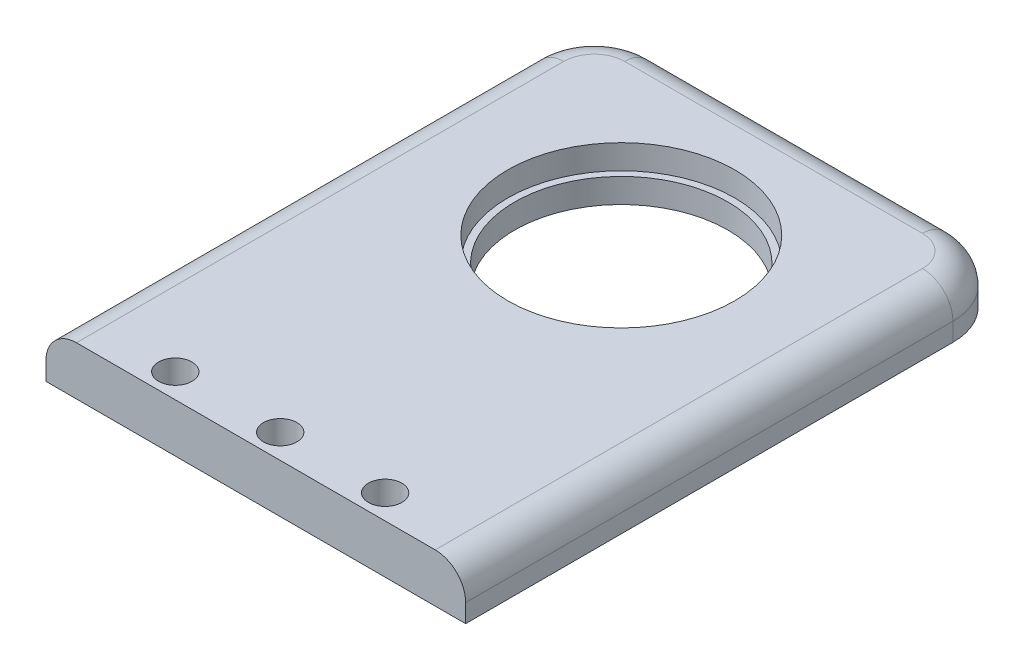
from build123d import *

# Parameters (mm, degrees)
SKETCH1_W           = 68.9
SKETCH1_H           = 90
SKETCH1_R           = 18.63
SKETCH1_R_2         = 2.75
BOSS_EXTRUDE1_DEPTH = 8
FILLET1_R           = 10
FILLET2_R           = 5
SKETCH2_R           = 18.63
SKETCH2_R_2         = 17.5
BOSS_EXTRUDE2_DEPTH = 4


with BuildPart() as part:
    # Sketch1 → Boss-Extrude1 (new body)
    with BuildSketch(Plane(origin=(0, 0, 0), x_dir=(1, 0, 0), z_dir=(0, 1, 0))):
        with Locations((0.722348924, 5)):
            Rectangle(SKETCH1_W, SKETCH1_H)
        with Locations(Location((0.722348924, 20, 0), (0, 0, 270))):
            Circle(SKETCH1_R, mode=Mode.SUBTRACT)
        with Locations(Location((0.722348924, -36, 0), (0, 0, 270))):
            Circle(SKETCH1_R_2, mode=Mode.SUBTRACT)
        with Locations(Location((-16.502651076, -36, 0), (0, 0, 270))):
            Circle(SKETCH1_R_2, mode=Mode.SUBTRACT)
        with Locations(Location((17.947348924, -36, 0), (0, 0, 270))):
            Circle(SKETCH1_R_2, mode=Mode.SUBTRACT)
    extrude(amount=BOSS_EXTRUDE1_DEPTH)

    # Fillet1
    fillet1_edges = [part.edges().sort_by_distance(p)[0] for p in [
        (-33.727651076, 4, -50),
        (35.172348924, 4, -50),
    ]]
    fillet(fillet1_edges, radius=FILLET1_R)

    # Fillet2
    fillet2_edges = [part.edges().sort_by_distance(p)[0] for p in [
        (35.172348924, 8, 0),
        (0.722348924, 8, -50),
        (-33.727651076, 8, 0),
        (-30.798718888, 8, -47.071067812),
        (32.243416735, 8, -47.071067812),
    ]]
    fillet(fillet2_edges, radius=FILLET2_R)

    # Sketch2 → Boss-Extrude2 (add)
    with BuildSketch(Plane.XZ):
        with Locations(Location((0.722348924, -20, 0), (0, 0, 270))):
            Circle(SKETCH2_R)
        with Locations(Location((0.722348924, -20, 0), (0, 0, 270))):
            Circle(SKETCH2_R_2, mode=Mode.SUBTRACT)
    extrude(amount=-BOSS_EXTRUDE2_DEPTH)


solid = part.part
